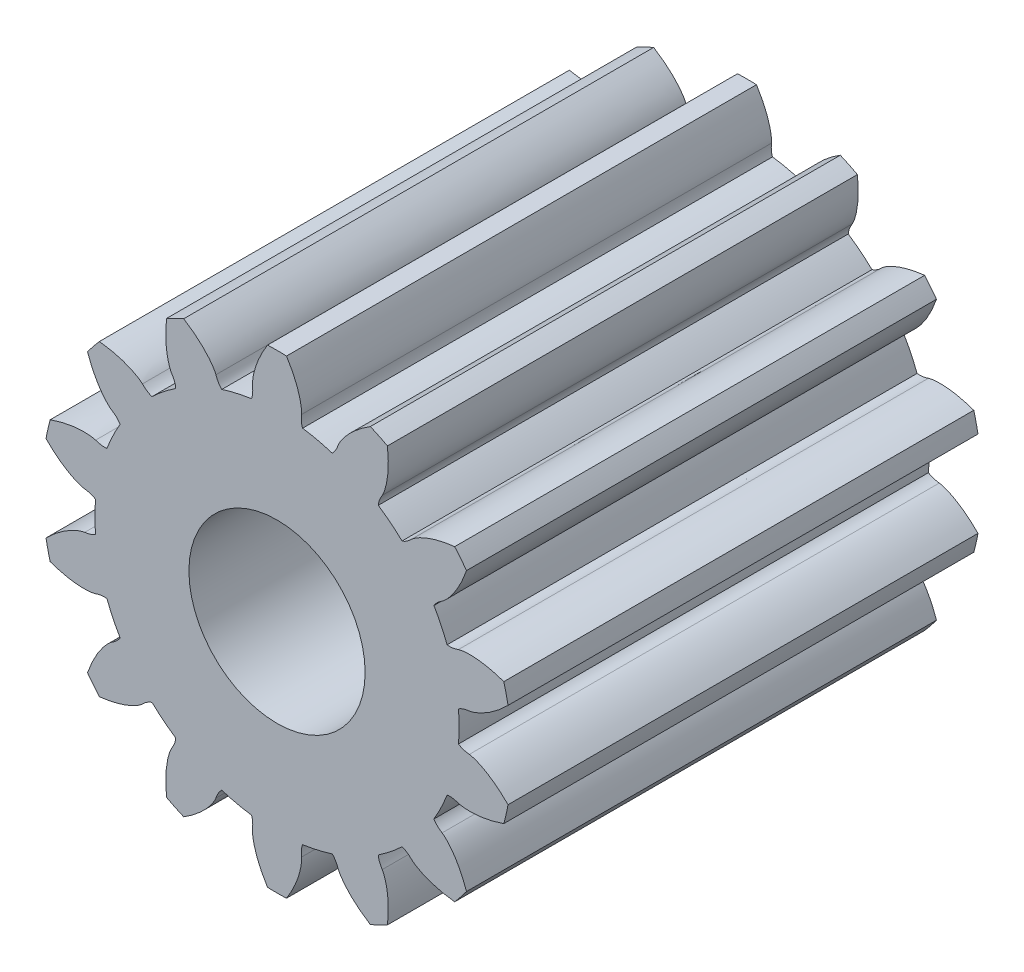
from build123d import *

# Parameters (mm, degrees)
SKETCH_1_R               = 1.55
EXTRUDE_1_DEPTH          = 4
EXTRUDE_2_DEPTH          = 4
PATTERN_CIRCULAR_1_COUNT = 14
SKETCH_3_R               = 0.75
CUT_EXTRUDE_1_DEPTH      = 5.885290377


with BuildPart() as part:
    # 스케치1 → 돌출1 (new body)
    with BuildSketch(Plane.XY):
        Circle(SKETCH_1_R)
    extrude(amount=EXTRUDE_1_DEPTH)

    # 스케치2 → 돌출2 (add)
    with BuildSketch(Plane(origin=(0, 0, 0), x_dir=(-1, 0, 0), z_dir=(0, 0, -1))):
        with BuildLine():
            ThreePointArc((-0.080725672, 1.998370177), (0, 2), (0.080725672, 1.998370177))
            add(Edge.make_bspline(
                [(0.208460792, 1.631238957), (0.208634794, 1.633580739), (0.209280567, 1.64227175), (0.208718038, 1.661399071), (0.205632694, 1.692412374), (0.197607789, 1.734923128), (0.18287908, 1.788243911), (0.159400787, 1.851394521), (0.125854917, 1.923467003), (0.096460297, 1.972254665), (0.080725672, 1.998370177)],
                knots=[0, 0, 0, 0, 0.017883716, 0.066371521, 0.145464067, 0.25516146, 0.395463736, 0.566370912, 0.767882998, 1, 1, 1, 1], degree=3))
            add(Edge.make_bspline(
                [(0.208460792, 1.631238957), (0.207716363, 1.623751077), (0.20625949, 1.609097025), (0.206368987, 1.587312397), (0.208495692, 1.566066619), (0.213291713, 1.544911756), (0.221817788, 1.523345639), (0.236140656, 1.501697819), (0.258499748, 1.481424248), (0.278749361, 1.475134824), (0.289478899, 1.471802285)],
                knots=[0, 0, 0, 0, 0.114365355, 0.223817134, 0.330659673, 0.438470498, 0.552748632, 0.68118184, 0.831069791, 1, 1, 1, 1], degree=3))
            ThreePointArc((0.289478899, 1.471802285), (0, 1.5), (-0.289478899, 1.471802285))
            add(Edge.make_bspline(
                [(-0.208460792, 1.631238957), (-0.207716363, 1.623751077), (-0.20625949, 1.609097025), (-0.206368987, 1.587312397), (-0.208495692, 1.566066619), (-0.213291713, 1.544911756), (-0.221817788, 1.523345639), (-0.236140656, 1.501697819), (-0.258499748, 1.481424248), (-0.278749361, 1.475134824), (-0.289478899, 1.471802285)],
                knots=[0, 0, 0, 0, 0.114365355, 0.223817134, 0.330659673, 0.438470498, 0.552748632, 0.68118184, 0.831069791, 1, 1, 1, 1], degree=3))
            add(Edge.make_bspline(
                [(-0.208460792, 1.631238957), (-0.208634794, 1.633580739), (-0.209280567, 1.64227175), (-0.208718038, 1.661399071), (-0.205632694, 1.692412374), (-0.197607789, 1.734923128), (-0.18287908, 1.788243911), (-0.159400787, 1.851394521), (-0.125854917, 1.923467003), (-0.096460297, 1.972254665), (-0.080725672, 1.998370177)],
                knots=[0, 0, 0, 0, 0.017883716, 0.066371521, 0.145464067, 0.25516146, 0.395463736, 0.566370912, 0.767882998, 1, 1, 1, 1], degree=3))
        make_face()
    extrude_2 = extrude(amount=-EXTRUDE_2_DEPTH)

    # 원형 패턴1: 돌출2 ×14 about axis
    pattern_circular_1_axis = Axis((0, 0, -88.99), (0, 0, 1))
    for i in range(1, PATTERN_CIRCULAR_1_COUNT):
        add(extrude_2.rotate(pattern_circular_1_axis, i * 360 / PATTERN_CIRCULAR_1_COUNT))

    # 스케치3 → 컷-돌출1 (cut, through all)
    with BuildSketch(Plane.XY.offset(4)):
        Circle(SKETCH_3_R)
    extrude(amount=-CUT_EXTRUDE_1_DEPTH, mode=Mode.SUBTRACT)


solid = part.part
